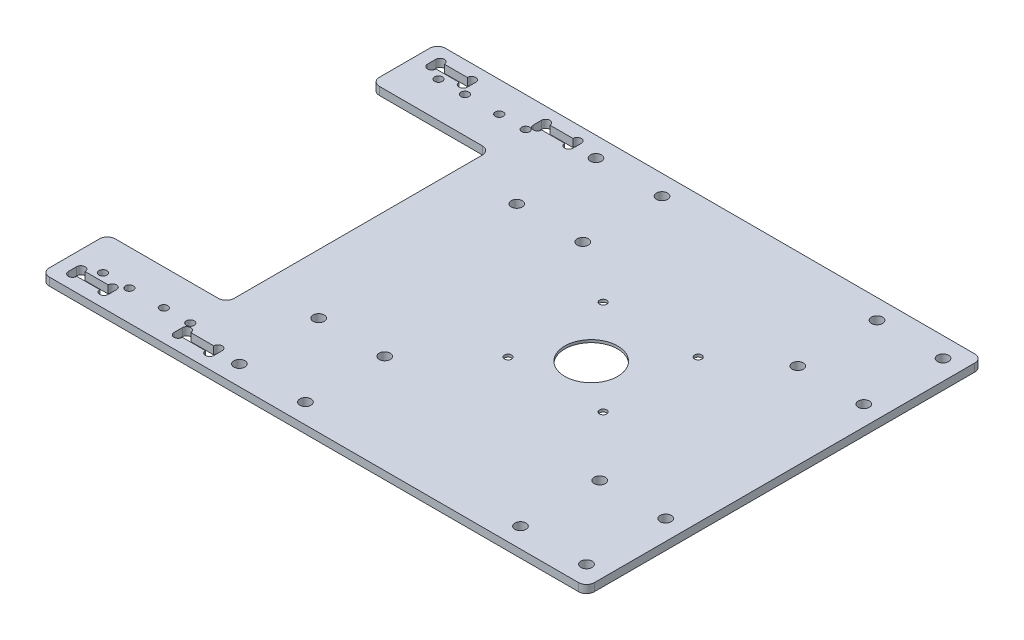
from build123d import *

# Parameters (mm, degrees)
SKETCH_1_W          = 206.4
SKETCH_1_H          = 150
SKETCH_1_R          = 2.1
SKETCH_1_R_2        = 1.5
EXTRUDE_1_DEPTH     = 3
CUT_EXTRUDE_1_DEPTH = 153.892903694
FILLET_1_R          = 3
CUT_EXTRUDE_2_DEPTH = 2
SKETCH_6_R          = 10
CUT_EXTRUDE_3_DEPTH = 10
SKETCH_7_W          = 45
SKETCH_7_H          = 100
CUT_EXTRUDE_4_DEPTH = 10
FILLET_2_R          = 3
CUT_EXTRUDE_5_DEPTH = 10


with BuildPart() as part:
    # 草图1 → 凸台-拉伸1 (new body)
    with BuildSketch(Plane(origin=(0, 0, 0), x_dir=(1, 0, 0), z_dir=(0, 1, 0))):
        with Locations((-30, 0)):
            Rectangle(SKETCH_1_W, SKETCH_1_H)
        with Locations(Location((65.7, 67.5, 0), (0, 0, 270))):
            Circle(SKETCH_1_R, mode=Mode.SUBTRACT)
        with Locations(Location((65.7, -67.5, 0), (0, 0, 90))):
            Circle(SKETCH_1_R, mode=Mode.SUBTRACT)
        with Locations(Location((-65.7, -67.5, 0), (0, 0, 270))):
            Circle(SKETCH_1_R, mode=Mode.SUBTRACT)
        with Locations(Location((-65.7, 67.5, 0), (0, 0, 90))):
            Circle(SKETCH_1_R, mode=Mode.SUBTRACT)
        with Locations(Location((-65.7, 37.5, 0), (0, 0, 270))):
            Circle(SKETCH_1_R, mode=Mode.SUBTRACT)
        with Locations(Location((-40.7, 37.5, 0), (0, 0, 270))):
            Circle(SKETCH_1_R, mode=Mode.SUBTRACT)
        with Locations(Location((-40.7, 67.5, 0), (0, 0, 270))):
            Circle(SKETCH_1_R, mode=Mode.SUBTRACT)
        with Locations(Location((-40.7, -67.5, 0), (0, 0, 270))):
            Circle(SKETCH_1_R, mode=Mode.SUBTRACT)
        with Locations(Location((-40.7, -37.5, 0), (0, 0, 270))):
            Circle(SKETCH_1_R, mode=Mode.SUBTRACT)
        with Locations(Location((-65.7, -37.5, 0), (0, 0, 270))):
            Circle(SKETCH_1_R, mode=Mode.SUBTRACT)
        with Locations(Location((40.7, -67.5, 0), (0, 0, 270))):
            Circle(SKETCH_1_R, mode=Mode.SUBTRACT)
        with Locations(Location((40.7, -37.5, 0), (0, 0, 270))):
            Circle(SKETCH_1_R, mode=Mode.SUBTRACT)
        with Locations(Location((65.7, -37.5, 0), (0, 0, 270))):
            Circle(SKETCH_1_R, mode=Mode.SUBTRACT)
        with Locations(Location((65.7, 37.5, 0), (0, 0, 270))):
            Circle(SKETCH_1_R, mode=Mode.SUBTRACT)
        with Locations(Location((40.7, 37.5, 0), (0, 0, 270))):
            Circle(SKETCH_1_R, mode=Mode.SUBTRACT)
        with Locations(Location((40.7, 67.5, 0), (0, 0, 270))):
            Circle(SKETCH_1_R, mode=Mode.SUBTRACT)
        with Locations(Location((-98.4, 63.575, 0), (0, 0, 270))):
            Circle(SKETCH_1_R_2, mode=Mode.SUBTRACT)
        with Locations(Location((-88.4, 63.575, 0), (0, 0, 270))):
            Circle(SKETCH_1_R_2, mode=Mode.SUBTRACT)
        with Locations(Location((-111.4, 63.575, 0), (0, 0, 270))):
            Circle(SKETCH_1_R_2, mode=Mode.SUBTRACT)
        with Locations(Location((-121.4, 63.575, 0), (0, 0, 270))):
            Circle(SKETCH_1_R_2, mode=Mode.SUBTRACT)
        with Locations(Location((-121.4, -63.474999999, 0), (0, 0, 270))):
            Circle(SKETCH_1_R_2, mode=Mode.SUBTRACT)
        with Locations(Location((-111.4, -63.474999999, 0), (0, 0, 270))):
            Circle(SKETCH_1_R_2, mode=Mode.SUBTRACT)
        with Locations(Location((-98.4, -63.425, 0), (0, 0, 270))):
            Circle(SKETCH_1_R_2, mode=Mode.SUBTRACT)
        with Locations(Location((-88.4, -63.425, 0), (0, 0, 270))):
            Circle(SKETCH_1_R_2, mode=Mode.SUBTRACT)
    extrude(amount=EXTRUDE_1_DEPTH)

    # 草图2 → 切除-拉伸1 (cut, through all)
    with BuildSketch(Plane(origin=(0, 0, 0), x_dir=(1, 0, 0), z_dir=(0, 1, 0))):
        with BuildLine():
            Line((-125.2, -66.425), (-116.5, -66.425))
            ThreePointArc((-116.5, -66.425), (-114.9, -64.825), (-113.3, -66.425))
            Line((-113.3, -66.425), (-113.3, -69.575))
            ThreePointArc((-113.3, -69.575), (-114.9, -71.175), (-116.5, -69.575))
            Line((-116.5, -69.575), (-125.2, -69.575))
            ThreePointArc((-125.2, -69.575), (-126.8, -71.175), (-128.4, -69.575))
            Line((-128.4, -69.575), (-128.4, -66.425))
            ThreePointArc((-128.4, -66.425), (-126.8, -64.825), (-125.2, -66.425))
        make_face()
        with BuildLine():
            Line((-85.2, -66.425), (-76.5, -66.425))
            ThreePointArc((-76.5, -66.425), (-74.9, -64.825), (-73.3, -66.425))
            Line((-73.3, -66.425), (-73.3, -69.575))
            ThreePointArc((-73.3, -69.575), (-74.9, -71.175), (-76.5, -69.575))
            Line((-76.5, -69.575), (-85.2, -69.575))
            ThreePointArc((-85.2, -69.575), (-86.8, -71.175), (-88.4, -69.575))
            Line((-88.4, -69.575), (-88.4, -66.425))
            ThreePointArc((-88.4, -66.425), (-86.8, -64.825), (-85.2, -66.425))
        make_face()
        with BuildLine():
            Line((-73.3, 66.425), (-73.3, 69.575))
            ThreePointArc((-73.3, 69.575), (-74.9, 71.175), (-76.5, 69.575))
            Line((-76.5, 69.575), (-85.2, 69.575))
            ThreePointArc((-85.2, 69.575), (-86.8, 71.175), (-88.4, 69.575))
            Line((-88.4, 69.575), (-88.4, 66.425))
            ThreePointArc((-88.4, 66.425), (-86.8, 64.825), (-85.2, 66.425))
            Line((-85.2, 66.425), (-76.5, 66.425))
            ThreePointArc((-76.5, 66.425), (-74.9, 64.825), (-73.3, 66.425))
        make_face()
        with BuildLine():
            Line((-113.3, 66.425), (-113.3, 69.575))
            ThreePointArc((-113.3, 69.575), (-114.9, 71.175), (-116.5, 69.575))
            Line((-116.5, 69.575), (-125.2, 69.575))
            ThreePointArc((-125.2, 69.575), (-126.8, 71.175), (-128.4, 69.575))
            Line((-128.4, 69.575), (-128.4, 66.425))
            ThreePointArc((-128.4, 66.425), (-126.8, 64.825), (-125.2, 66.425))
            Line((-125.2, 66.425), (-116.5, 66.425))
            ThreePointArc((-116.5, 66.425), (-114.9, 64.825), (-113.3, 66.425))
        make_face()
    extrude(amount=CUT_EXTRUDE_1_DEPTH, mode=Mode.SUBTRACT)

    # 圆角1
    fillet_1_edges = [part.edges().sort_by_distance(p)[0] for p in [
        (73.2, 1.5, 75),
        (-133.2, 1.5, 75),
        (-133.2, 1.5, -75),
        (73.2, 1.5, -75),
    ]]
    fillet(fillet_1_edges, radius=FILLET_1_R)

    # 草图4 → 切除-拉伸2 (cut)
    with BuildSketch(Plane(origin=(0, 0, 0), x_dir=(1, 0, 0), z_dir=(0, 1, 0))):
        with BuildLine():
            Line((-120.7, -27.5), (60.7, -27.5))
            ThreePointArc((60.7, -27.5), (64.235533906, -26.035533906), (65.7, -22.5))
            Line((65.7, -22.5), (65.7, 22.5))
            ThreePointArc((65.7, 22.5), (64.235533906, 26.035533906), (60.7, 27.5))
            Line((60.7, 27.5), (-120.7, 27.5))
            ThreePointArc((-120.7, 27.5), (-124.235533906, 26.035533906), (-125.7, 22.5))
            Line((-125.7, 22.5), (-125.7, -22.5))
            ThreePointArc((-125.7, -22.5), (-124.235533906, -26.035533906), (-120.7, -27.5))
        make_face()
    extrude(amount=CUT_EXTRUDE_2_DEPTH, mode=Mode.SUBTRACT)

    # 草图6 → 切除-拉伸3 (cut)
    with BuildSketch(Plane(origin=(0, 3, 0), x_dir=(1, 0, 0), z_dir=(0, 1, 0))):
        with Locations(Location((0, 0, 0), (0, 0, 270))):
            Circle(SKETCH_6_R)
    extrude(amount=-CUT_EXTRUDE_3_DEPTH, mode=Mode.SUBTRACT)

    # 草图7 → 切除-拉伸4 (cut)
    with BuildSketch(Plane(origin=(0, 3, 0), x_dir=(1, 0, 0), z_dir=(0, 1, 0))):
        with Locations((-110.7, 0)):
            Rectangle(SKETCH_7_W, SKETCH_7_H)
    extrude(amount=-CUT_EXTRUDE_4_DEPTH, mode=Mode.SUBTRACT)

    # 圆角2
    fillet_2_edges = [part.edges().sort_by_distance(p)[0] for p in [
        (-133.2, 1.5, 50),
        (-133.2, 1.5, -50),
        (-88.2, 1.5, -50),
        (-88.2, 1.5, 50),
    ]]
    fillet(fillet_2_edges, radius=FILLET_2_R)

    # 草图8 → 切除-拉伸5 (cut)
    with BuildSketch(Plane.XZ.offset(-2)):
        with BuildLine():
            ThreePointArc((17.542961637, 14.384893438), (18.892961637, 13.034893438), (20.242961637, 14.384893438))
            ThreePointArc((20.242961637, 14.384893438), (18.892961637, 15.734893438), (17.542961637, 14.384893438))
        make_face()
        with BuildLine():
            ThreePointArc((-18.457038363, 14.384893438), (-17.107038363, 13.034893438), (-15.757038363, 14.384893438))
            ThreePointArc((-15.757038363, 14.384893438), (-17.107038363, 15.734893438), (-18.457038363, 14.384893438))
        make_face()
        with BuildLine():
            ThreePointArc((-15.757038363, -21.615106562), (-17.107038363, -20.265106562), (-18.457038363, -21.615106562))
            ThreePointArc((-18.457038363, -21.615106562), (-17.107038363, -22.965106562), (-15.757038363, -21.615106562))
        make_face()
        with BuildLine():
            ThreePointArc((20.242961637, -21.615106562), (18.892961637, -20.265106562), (17.542961637, -21.615106562))
            ThreePointArc((17.542961637, -21.615106562), (18.892961637, -22.965106562), (20.242961637, -21.615106562))
        make_face()
    extrude(amount=-CUT_EXTRUDE_5_DEPTH, mode=Mode.SUBTRACT)


solid = part.part
